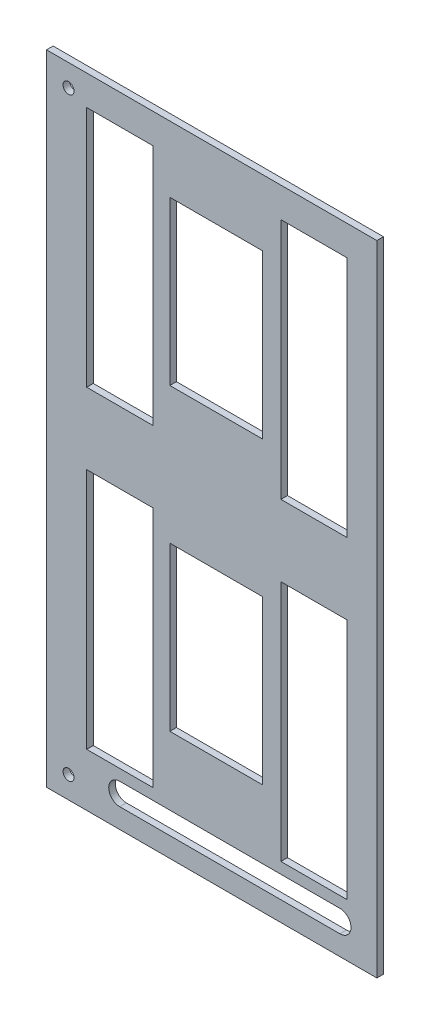
from build123d import *

# Parameters (mm, degrees)
SKETCH_2_W          = 150
SKETCH_2_H          = 290
EXTRUDE_1_DEPTH     = 3
SKETCH_3_W          = 42
SKETCH_3_H          = 74
CUT_EXTRUDE_1_DEPTH = 3
SKETCH_4_R          = 2.5
CUT_EXTRUDE_2_DEPTH = 3
SKETCH_5_W          = 30
SKETCH_5_H          = 110
CUT_EXTRUDE_3_DEPTH = 3
CUT_EXTRUDE_4_DEPTH = 3


with BuildPart() as part:
    # 草图2 → 凸台-拉伸1 (new body)
    with BuildSketch(Plane.XY):
        with Locations((46.825741224, -93.303848435)):
            Rectangle(SKETCH_2_W, SKETCH_2_H)
    extrude(amount=EXTRUDE_1_DEPTH)

    # 草图3 → 切除-拉伸1 (cut)
    with BuildSketch(Plane.XY.offset(3)):
        with Locations((48.825741224, -15.303848435)):
            Rectangle(SKETCH_3_W, SKETCH_3_H)
        with Locations((48.825741224, -151.303848435)):
            Rectangle(SKETCH_3_W, SKETCH_3_H)
    extrude(amount=-CUT_EXTRUDE_1_DEPTH, mode=Mode.SUBTRACT)

    # 草图4 → 切除-拉伸2 (cut)
    with BuildSketch(Plane.XY.offset(3)):
        with Locations((-18.174258776, 41.696151565)):
            Circle(SKETCH_4_R)
        with Locations((-18.174258776, -228.303848435)):
            Circle(SKETCH_4_R)
    extrude(amount=-CUT_EXTRUDE_2_DEPTH, mode=Mode.SUBTRACT)

    # 草图5 → 切除-拉伸3 (cut)
    with BuildSketch(Plane.XY.offset(3)):
        with Locations((5.068322333, -16.872516049)):
            Rectangle(SKETCH_5_W, SKETCH_5_H)
        with Locations((93.246188271, -16.872516049)):
            Rectangle(SKETCH_5_W, SKETCH_5_H)
        with Locations((5.068322333, -159.262913685)):
            Rectangle(SKETCH_5_W, SKETCH_5_H)
        with Locations((93.246188271, -159.262913685)):
            Rectangle(SKETCH_5_W, SKETCH_5_H)
    extrude(amount=-CUT_EXTRUDE_3_DEPTH, mode=Mode.SUBTRACT)

    # 草图6 → 切除-拉伸4 (cut)
    with BuildSketch(Plane.XY.offset(3)):
        with BuildLine():
            Line((5.068322333, -219.315553818), (105.068322333, -219.315553818))
            ThreePointArc((105.068322333, -219.315553818), (110.068322333, -224.315553818), (105.068322333, -229.315553818))
            Line((105.068322333, -229.315553818), (5.068322333, -229.315553818))
            ThreePointArc((5.068322333, -229.315553818), (0.068322333, -224.315553818), (5.068322333, -219.315553818))
        make_face()
    extrude(amount=-CUT_EXTRUDE_4_DEPTH, mode=Mode.SUBTRACT)


solid = part.part
